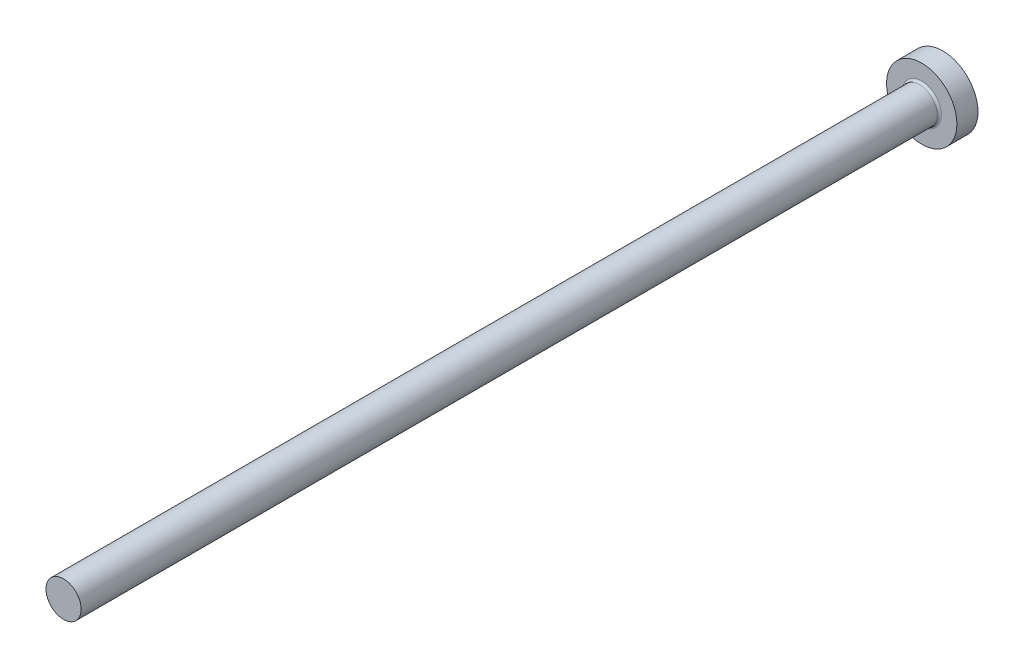
from build123d import *

# Parameters (mm, degrees)
SZKIC1_W = 3
SZKIC1_H = 5
SZKIC2_W = 122
SZKIC2_H = 2.5


with BuildPart() as part:
    # Szkic1 → Obrót1 (revolve)
    with BuildSketch(Plane(origin=(0, 0, 0), x_dir=(0, 0, -1), z_dir=(1, 0, 0))):
        with Locations((-1.5, 2.5)):
            Rectangle(SZKIC1_W, SZKIC1_H)
    revolve(axis=Axis((0, 0, 0), (0, 0, 1)))

    # Szkic2 → Obrót2 (revolve)
    with BuildSketch(Plane(origin=(0, 0, 0), x_dir=(0, 0, -1), z_dir=(1, 0, 0))):
        with Locations((-64, 1.25)):
            Rectangle(SZKIC2_W, SZKIC2_H)
    revolve(axis=Axis((0, 0, 3), (0, 0, 1)))

    # Szkic3 → Obrót3 (revolve)
    with BuildSketch(Plane(origin=(0, 0, 0), x_dir=(0, 0, -1), z_dir=(1, 0, 0))):
        with BuildLine():
            Line((-3.3, 2.5), (-3, 2.5))
            Line((-3, 2.5), (-3, 2.8))
            ThreePointArc((-3, 2.8), (-3.087867966, 2.587867966), (-3.3, 2.5))
        make_face()
    revolve(axis=Axis((0, 0, 0), (0, 0, 1)))


solid = part.part
